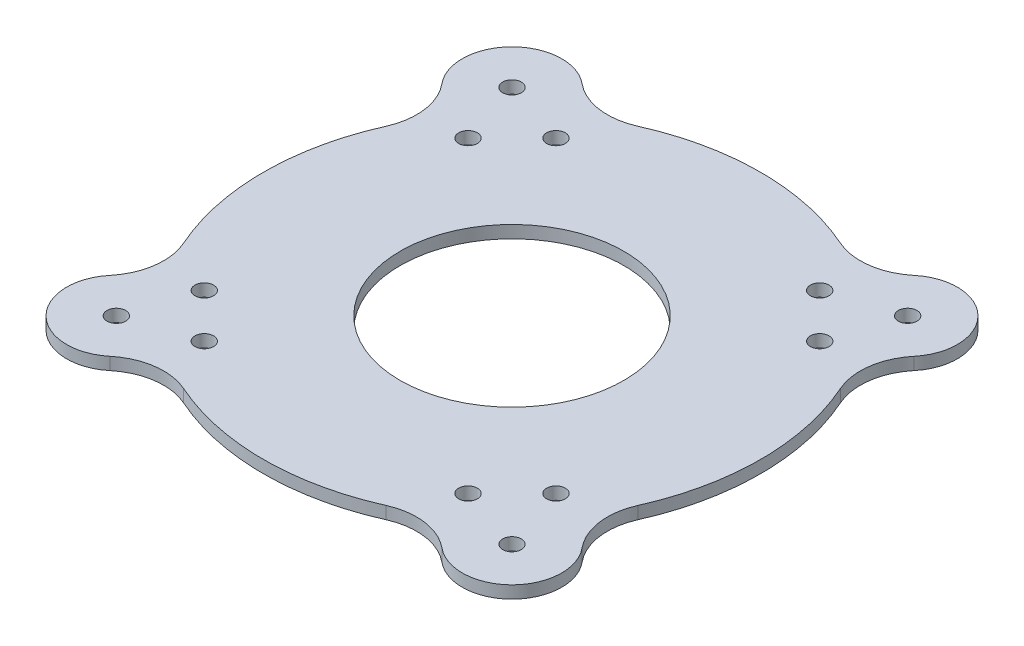
from build123d import *

# Parameters (mm, degrees)
SKETCH_1_R          = 40
SKETCH_1_R_2        = 18
EXTRUDE_1_DEPTH     = 2
EXTRUDE_2_DEPTH     = 2
FILLET_1_R          = 10
SKETCH_2_R          = 1.5
CUT_EXTRUDE_1_DEPTH = 57.603886937


with BuildPart() as part:
    # 草图1 → 凸台-拉伸1 (new body)
    with BuildSketch(Plane(origin=(0, 0, 0), x_dir=(1, 0, 0), z_dir=(0, 1, 0))):
        with Locations(Location((0, 0, 0), (0, 0, 270))):
            Circle(SKETCH_1_R)
        with Locations(Location((0, 0, 0), (0, 0, 270))):
            Circle(SKETCH_1_R_2, mode=Mode.SUBTRACT)
    extrude(amount=EXTRUDE_1_DEPTH)

    # 草图4 → 凸台-拉伸2 (add)
    with BuildSketch(Plane.XZ):
        with BuildLine():
            Line((19.091883092, 30.405591591), (26.162950904, 37.476659403))
            ThreePointArc((26.162950904, 37.476659403), (37.476659403, 37.476659403), (37.476659403, 26.162950904))
            Line((37.476659403, 26.162950904), (30.405591591, 19.091883092))
            ThreePointArc((30.405591591, 19.091883092), (19.091883092, 19.091883092), (19.091883092, 30.405591591))
        make_face()
        with BuildLine():
            Line((19.091883092, -30.405591591), (26.162950904, -37.476659403))
            ThreePointArc((26.162950904, -37.476659403), (37.476659403, -37.476659403), (37.476659403, -26.162950904))
            Line((37.476659403, -26.162950904), (30.405591591, -19.091883092))
            ThreePointArc((30.405591591, -19.091883092), (19.091883092, -19.091883092), (19.091883092, -30.405591591))
        make_face()
        with BuildLine():
            Line((-30.405591591, -19.091883092), (-37.476659403, -26.162950904))
            ThreePointArc((-37.476659403, -26.162950904), (-37.476659403, -37.476659403), (-26.162950904, -37.476659403))
            Line((-26.162950904, -37.476659403), (-19.091883092, -30.405591591))
            ThreePointArc((-19.091883092, -30.405591591), (-19.091883092, -19.091883092), (-30.405591591, -19.091883092))
        make_face()
        with BuildLine():
            Line((-19.091883092, 30.405591591), (-26.162950904, 37.476659403))
            ThreePointArc((-26.162950904, 37.476659403), (-37.476659403, 37.476659403), (-37.476659403, 26.162950904))
            Line((-37.476659403, 26.162950904), (-30.405591591, 19.091883092))
            ThreePointArc((-30.405591591, 19.091883092), (-19.091883092, 19.091883092), (-19.091883092, 30.405591591))
        make_face()
    extrude(amount=-EXTRUDE_2_DEPTH)

    # 圆角1
    fillet_1_edges = [part.edges().sort_by_distance(p)[0] for p in [
        (-22.055958672, 1, -33.369667171),
        (-33.369667171, 1, -22.055958672),
        (-33.369667171, 1, 22.055958672),
        (-22.055958672, 1, 33.369667171),
        (22.055958672, 1, 33.369667171),
        (33.369667171, 1, 22.055958672),
        (33.369667171, 1, -22.055958672),
        (22.055958672, 1, -33.369667171),
    ]]
    fillet(fillet_1_edges, radius=FILLET_1_R)

    # 草图2 → 切除-拉伸1 (cut, through all)
    with BuildSketch(Plane(origin=(0, 2, 0), x_dir=(1, 0, 0), z_dir=(0, 1, 0))):
        with Locations(Location((-21.213203436, -28.284271247, 0), (0, 0, 270))):
            Circle(SKETCH_2_R)
        with Locations(Location((-31.819805153, -31.819805153, 0), (0, 0, 270))):
            Circle(SKETCH_2_R)
        with Locations(Location((-28.284271247, -21.213203436, 0), (0, 0, 90))):
            Circle(SKETCH_2_R)
        with Locations(Location((-31.819805153, 31.819805153, 0), (0, 0, 270))):
            Circle(SKETCH_2_R)
        with Locations(Location((-21.213203436, 28.284271247, 0), (0, 0, 90))):
            Circle(SKETCH_2_R)
        with Locations(Location((-28.284271247, 21.213203436, 0), (0, 0, 270))):
            Circle(SKETCH_2_R)
        with Locations(Location((31.819805153, 31.819805153, 0), (0, 0, 270))):
            Circle(SKETCH_2_R)
        with Locations(Location((28.284271247, 21.213203436, 0), (0, 0, 90))):
            Circle(SKETCH_2_R)
        with Locations(Location((21.213203436, 28.284271247, 0), (0, 0, 270))):
            Circle(SKETCH_2_R)
        with Locations(Location((31.819805153, -31.819805153, 0), (0, 0, 270))):
            Circle(SKETCH_2_R)
        with Locations(Location((21.213203436, -28.284271247, 0), (0, 0, 90))):
            Circle(SKETCH_2_R)
        with Locations(Location((28.284271247, -21.213203436, 0), (0, 0, 270))):
            Circle(SKETCH_2_R)
    extrude(amount=-CUT_EXTRUDE_1_DEPTH, mode=Mode.SUBTRACT)


solid = part.part
